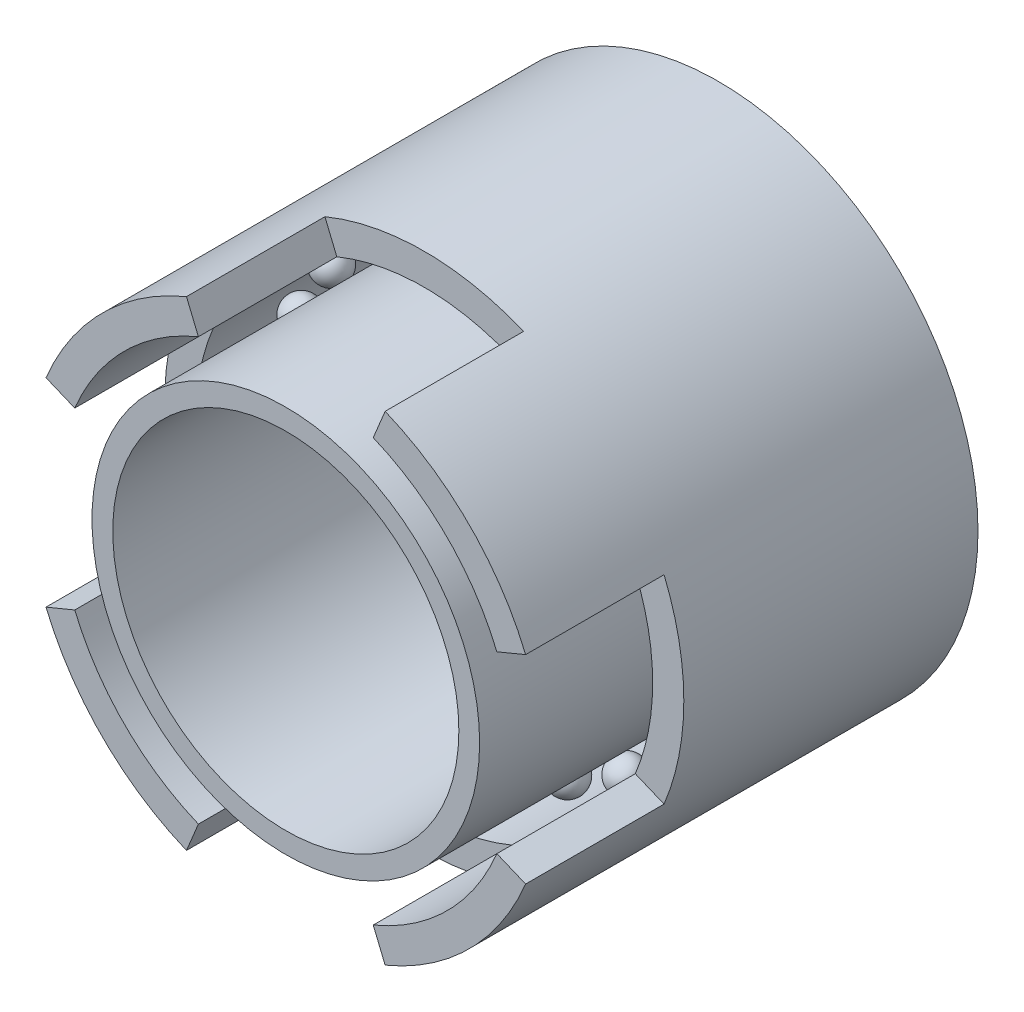
from build123d import *

# Parameters (mm, degrees)
SKETCH1_R             = 19.05
SKETCH1_R_2           = 16.764
BOSS_EXTRUDE1_DEPTH   = 31.75
SKETCH1_R_3           = 14.224
SKETCH1_R_4           = 12.7
BOSS_EXTRUDE1_2_DEPTH = 31.75
CIRPATTERN10_COUNT    = 20
CUT_EXTRUDE1_DEPTH    = 10.16


with BuildPart() as part:
    # Sketch1 → Boss-Extrude1 (new body)
    with BuildSketch(Plane.XY):
        Circle(SKETCH1_R)
        Circle(SKETCH1_R_2, mode=Mode.SUBTRACT)
    extrude(amount=-BOSS_EXTRUDE1_DEPTH)

    # Sketch3 → Cut-Extrude1 (cut)
    with BuildSketch(Plane.XY):
        with BuildLine():
            Line((-7.290119387, 17.599905094), (-6.41530506, 15.487916483))
            ThreePointArc((-6.41530506, 15.487916483), (0, 16.764), (6.41530506, 15.487916483))
            Line((6.41530506, 15.487916483), (7.290119387, 17.599905094))
            ThreePointArc((7.290119387, 17.599905094), (0, 19.05), (-7.290119387, 17.599905094))
        make_face()
        with BuildLine():
            Line((17.599905094, -7.290119387), (15.487916483, -6.41530506))
            ThreePointArc((15.487916483, -6.41530506), (16.764, 0), (15.487916483, 6.41530506))
            Line((15.487916483, 6.41530506), (17.599905094, 7.290119387))
            ThreePointArc((17.599905094, 7.290119387), (19.05, 0), (17.599905094, -7.290119387))
        make_face()
        with BuildLine():
            Line((-7.290119387, -17.599905094), (-6.41530506, -15.487916483))
            ThreePointArc((-6.41530506, -15.487916483), (0, -16.764), (6.41530506, -15.487916483))
            Line((6.41530506, -15.487916483), (7.290119387, -17.599905094))
            ThreePointArc((7.290119387, -17.599905094), (0, -19.05), (-7.290119387, -17.599905094))
        make_face()
        with BuildLine():
            Line((-17.599905094, 7.290119387), (-15.487916483, 6.41530506))
            ThreePointArc((-15.487916483, 6.41530506), (-16.764, 0), (-15.487916483, -6.41530506))
            Line((-15.487916483, -6.41530506), (-17.599905094, -7.290119387))
            ThreePointArc((-17.599905094, -7.290119387), (-19.05, 0), (-17.599905094, 7.290119387))
        make_face()
    extrude(amount=-CUT_EXTRUDE1_DEPTH, mode=Mode.SUBTRACT)


with BuildPart() as body_2:
    # Sketch1 → Boss-Extrude1 2 (new body)
    with BuildSketch(Plane.XY):
        Circle(SKETCH1_R_3)
        Circle(SKETCH1_R_4, mode=Mode.SUBTRACT)
    extrude(amount=-BOSS_EXTRUDE1_2_DEPTH)


with BuildPart() as body_3:
    # Sketch2 → Revolve1 (revolve)
    with BuildSketch(Plane(origin=(0, 0, 0), x_dir=(1, 0, 0), z_dir=(0, 1, 0))):
        with BuildLine():
            Line((14.224, 15.875), (16.764, 15.875))
            ThreePointArc((16.764, 15.875), (15.494, 17.145), (14.224, 15.875))
        make_face()
    revolve(axis=Axis((14.224, 0, -15.875), (1, 0, 0)))


with BuildPart() as cirpattern10_1:
    # CirPattern10: pattern copy
    add(body_3.part.rotate(Axis((0, 0, 0), (0, 0, 1)), 1 * 360 / CIRPATTERN10_COUNT))


with BuildPart() as cirpattern10_2:
    # CirPattern10: pattern copy
    add(body_3.part.rotate(Axis((0, 0, 0), (0, 0, 1)), 2 * 360 / CIRPATTERN10_COUNT))


with BuildPart() as cirpattern10_3:
    # CirPattern10: pattern copy
    add(body_3.part.rotate(Axis((0, 0, 0), (0, 0, 1)), 3 * 360 / CIRPATTERN10_COUNT))


with BuildPart() as cirpattern10_4:
    # CirPattern10: pattern copy
    add(body_3.part.rotate(Axis((0, 0, 0), (0, 0, 1)), 4 * 360 / CIRPATTERN10_COUNT))


with BuildPart() as cirpattern10_5:
    # CirPattern10: pattern copy
    add(body_3.part.rotate(Axis((0, 0, 0), (0, 0, 1)), 5 * 360 / CIRPATTERN10_COUNT))


with BuildPart() as cirpattern10_6:
    # CirPattern10: pattern copy
    add(body_3.part.rotate(Axis((0, 0, 0), (0, 0, 1)), 6 * 360 / CIRPATTERN10_COUNT))


with BuildPart() as cirpattern10_7:
    # CirPattern10: pattern copy
    add(body_3.part.rotate(Axis((0, 0, 0), (0, 0, 1)), 7 * 360 / CIRPATTERN10_COUNT))


with BuildPart() as cirpattern10_8:
    # CirPattern10: pattern copy
    add(body_3.part.rotate(Axis((0, 0, 0), (0, 0, 1)), 8 * 360 / CIRPATTERN10_COUNT))


with BuildPart() as cirpattern10_9:
    # CirPattern10: pattern copy
    add(body_3.part.rotate(Axis((0, 0, 0), (0, 0, 1)), 9 * 360 / CIRPATTERN10_COUNT))


with BuildPart() as cirpattern10_10:
    # CirPattern10: pattern copy
    add(body_3.part.rotate(Axis((0, 0, 0), (0, 0, 1)), 10 * 360 / CIRPATTERN10_COUNT))


with BuildPart() as cirpattern10_11:
    # CirPattern10: pattern copy
    add(body_3.part.rotate(Axis((0, 0, 0), (0, 0, 1)), 11 * 360 / CIRPATTERN10_COUNT))


with BuildPart() as cirpattern10_12:
    # CirPattern10: pattern copy
    add(body_3.part.rotate(Axis((0, 0, 0), (0, 0, 1)), 12 * 360 / CIRPATTERN10_COUNT))


with BuildPart() as cirpattern10_13:
    # CirPattern10: pattern copy
    add(body_3.part.rotate(Axis((0, 0, 0), (0, 0, 1)), 13 * 360 / CIRPATTERN10_COUNT))


with BuildPart() as cirpattern10_14:
    # CirPattern10: pattern copy
    add(body_3.part.rotate(Axis((0, 0, 0), (0, 0, 1)), 14 * 360 / CIRPATTERN10_COUNT))


with BuildPart() as cirpattern10_15:
    # CirPattern10: pattern copy
    add(body_3.part.rotate(Axis((0, 0, 0), (0, 0, 1)), 15 * 360 / CIRPATTERN10_COUNT))


with BuildPart() as cirpattern10_16:
    # CirPattern10: pattern copy
    add(body_3.part.rotate(Axis((0, 0, 0), (0, 0, 1)), 16 * 360 / CIRPATTERN10_COUNT))


with BuildPart() as cirpattern10_17:
    # CirPattern10: pattern copy
    add(body_3.part.rotate(Axis((0, 0, 0), (0, 0, 1)), 17 * 360 / CIRPATTERN10_COUNT))


with BuildPart() as cirpattern10_18:
    # CirPattern10: pattern copy
    add(body_3.part.rotate(Axis((0, 0, 0), (0, 0, 1)), 18 * 360 / CIRPATTERN10_COUNT))


with BuildPart() as cirpattern10_19:
    # CirPattern10: pattern copy
    add(body_3.part.rotate(Axis((0, 0, 0), (0, 0, 1)), 19 * 360 / CIRPATTERN10_COUNT))


solid = Compound([part.part, body_2.part, body_3.part, cirpattern10_1.part, cirpattern10_2.part, cirpattern10_3.part, cirpattern10_4.part, cirpattern10_5.part, cirpattern10_6.part, cirpattern10_7.part, cirpattern10_8.part, cirpattern10_9.part, cirpattern10_10.part, cirpattern10_11.part, cirpattern10_12.part, cirpattern10_13.part, cirpattern10_14.part, cirpattern10_15.part, cirpattern10_16.part, cirpattern10_17.part, cirpattern10_18.part, cirpattern10_19.part])
